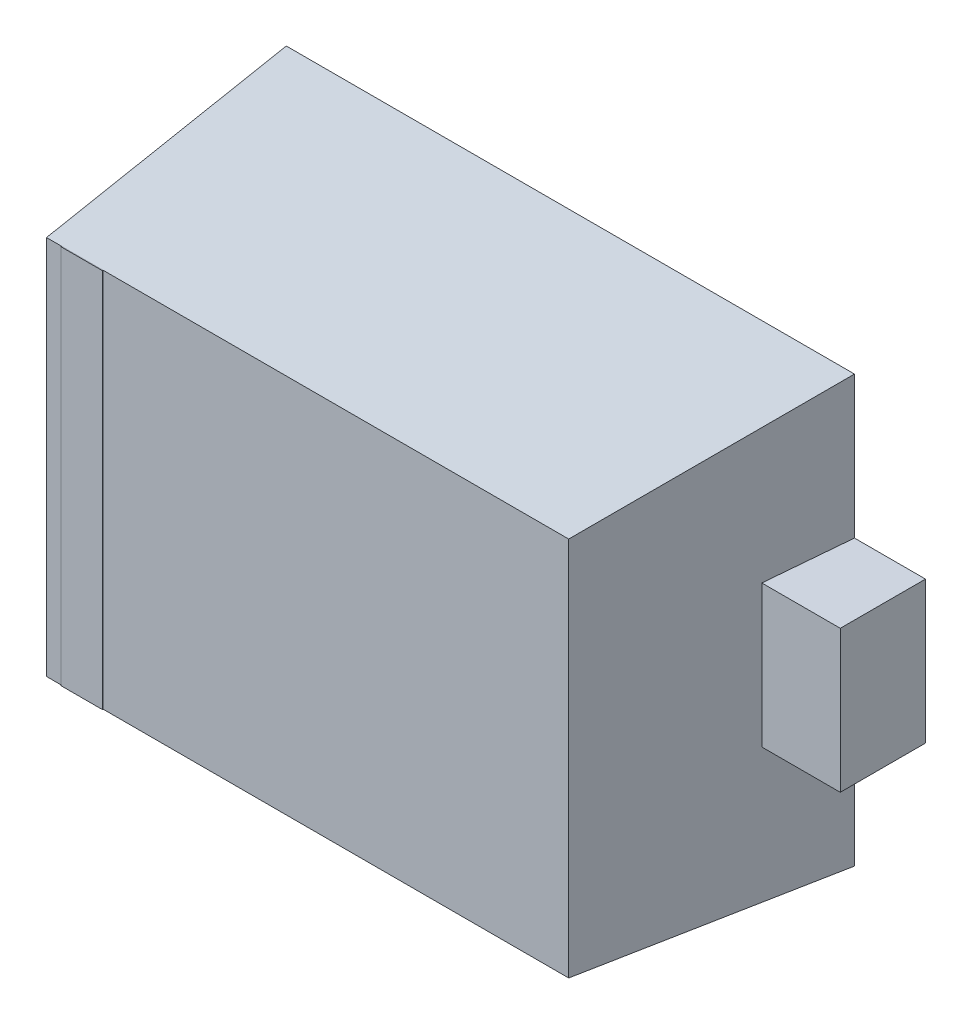
from build123d import *

# Parameters (mm, degrees)
SKETCH1_W             = 0.8
SKETCH1_H             = 0.6
BOSS_EXTRUDE1_DEPTH   = 0.37
BOSS_EXTRUDE1_TAPER   = 5
SKETCH2_W             = 0.19
SKETCH2_H             = 0.2
BOSS_EXTRUDE2_DEPTH   = 0.12
BOSS_EXTRUDE2_2_DEPTH = 0.12
SKETCH3_W             = 0.058316593
SKETCH3_H             = 0.535258388
BOSS_EXTRUDE3_DEPTH   = 0.001


with BuildPart() as part:
    # Sketch1 → Boss-Extrude1 (new body)
    with BuildSketch(Plane.XY):
        Rectangle(SKETCH1_W, SKETCH1_H)
    extrude(amount=BOSS_EXTRUDE1_DEPTH, taper=BOSS_EXTRUDE1_TAPER)

    # Sketch3 → Boss-Extrude3 (add)
    with BuildSketch(Plane.XY.offset(0.37)):
        with Locations((-0.316946175, 0)):
            Rectangle(SKETCH3_W, SKETCH3_H)
    extrude(amount=BOSS_EXTRUDE3_DEPTH)


with BuildPart() as body_2:
    # Sketch2 → Boss-Extrude2 (new body)
    with BuildSketch(Plane(origin=(0, 0, 0), x_dir=(-1, 0, 0), z_dir=(0, 0, -1))):
        with Locations((0.405, 0)):
            Rectangle(SKETCH2_W, SKETCH2_H)
    extrude(amount=-BOSS_EXTRUDE2_DEPTH)


with BuildPart() as body_3:
    # Sketch2 → Boss-Extrude2 2 (new body)
    with BuildSketch(Plane(origin=(0, 0, 0), x_dir=(-1, 0, 0), z_dir=(0, 0, -1))):
        with Locations((-0.405, 0)):
            Rectangle(SKETCH2_W, SKETCH2_H)
    extrude(amount=-BOSS_EXTRUDE2_2_DEPTH)


solid = Compound([part.part, body_2.part, body_3.part])
